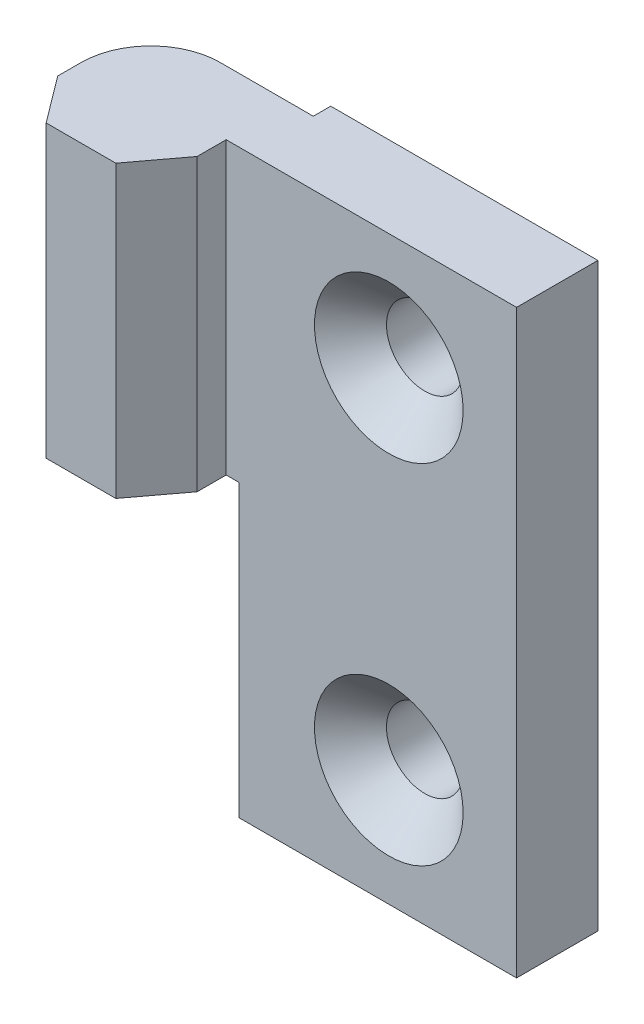
from build123d import *

# Parameters (mm, degrees)
EXTRUDE_1_DEPTH           = 50
FILLET_1_R                = 6
HOLE_WIZARD_1_D           = 6.6
HOLE_WIZARD_1_CSINK_D     = 12.8
HOLE_WIZARD_1_CSINK_ANGLE = 90


with BuildPart() as part:
    # 草图1 → 凸台-拉伸1 (new body)
    with BuildSketch(Plane(origin=(0, 0, 0), x_dir=(1, 0, 0), z_dir=(0, 1, 0))):
        Polygon((0, 0), (-25, 0), (-25, -2.5), (-28, -6.5), (-34, -6.5), (-37, -2.5), (-37, 5.5), (-23, 5.5), (-23, 7), (0, 7), align=None)
    extrude(amount=EXTRUDE_1_DEPTH)

    # 圆角1
    fillet_1_edges = [part.edges().sort_by_distance(p)[0] for p in [
        (-37, 25, -5.5),
    ]]
    fillet(fillet_1_edges, radius=FILLET_1_R)

    # 打孔尺寸根据内六角花形半沉头螺钉的类型1 (through all)
    with Locations(Plane.XY):
        with Locations((-11, 40), (-11, 10)):
            CounterSinkHole(HOLE_WIZARD_1_D / 2, HOLE_WIZARD_1_CSINK_D / 2, counter_sink_angle=HOLE_WIZARD_1_CSINK_ANGLE)

    # 草图2 → 切除-放样1 section 0
    with BuildSketch(Plane.XY.offset(6.5)):
        with BuildLine():
            Line((-37, 0), (-25, 0))
            Line((-25, 0), (-25, 25))
            Line((-25, 25), (-37, 25))
            Line((-37, 25), (-37, 0))
        make_face()
    # 草图5 → 切除-放样1 section 1
    with BuildSketch(Plane(origin=(0, 0, -5.5), x_dir=(-1, 0, 0), z_dir=(0, 0, -1))):
        with BuildLine():
            Line((37, 25), (23, 25))
            Line((23, 25), (23, 0))
            Line((23, 0), (37, 0))
            Line((37, 0), (37, 25))
        make_face()
    loft(mode=Mode.SUBTRACT)


solid = part.part
